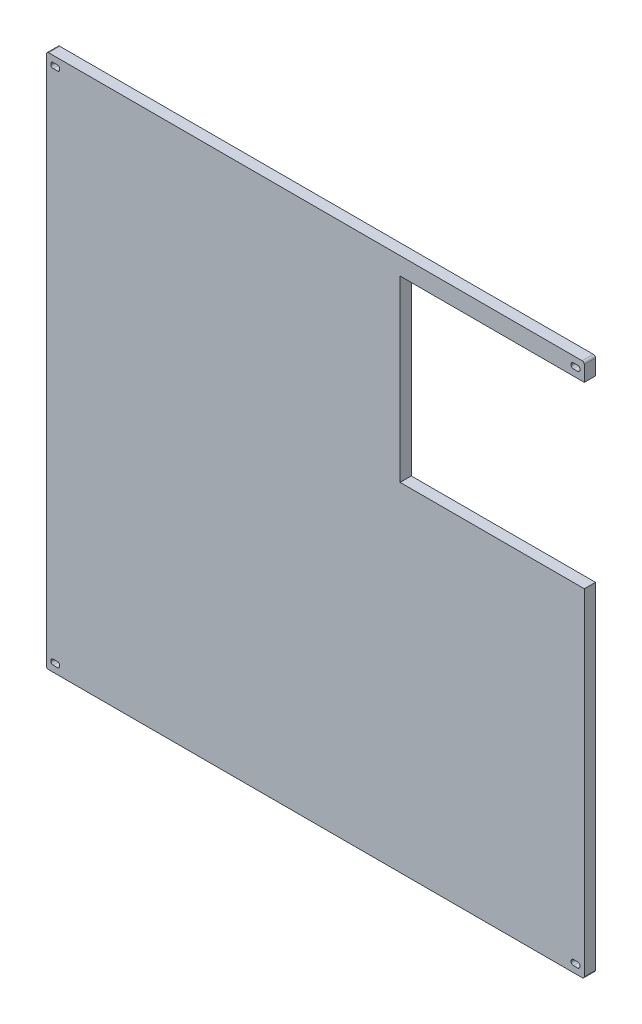
from build123d import *

# Parameters (mm, degrees)
BOSS_EXTRUDE2_DEPTH = 12.7
FILLET2_R           = 2.5


with BuildPart() as part:
    # Sketch1 → Boss-Extrude2 (new body)
    with BuildSketch(Plane.XY):
        Polygon((0, 0), (-611.632, 0), (-611.632, 607.568), (0, 607.568), (0, 587.480907233), (-209.519092864, 587.480907233), (-209.519092864, 384.280907233), (0, 384.280907233), align=None)
        with BuildLine():
            Line((-5, 10.5), (-5, 9.5))
            ThreePointArc((-5, 9.5), (-5.732233047, 7.732233047), (-7.5, 7))
            Line((-7.5, 7), (-12.5, 7))
            ThreePointArc((-12.5, 7), (-14.267766953, 7.732233047), (-15, 9.5))
            Line((-15, 9.5), (-15, 10.5))
            ThreePointArc((-15, 10.5), (-14.267766953, 12.267766953), (-12.5, 13))
            Line((-12.5, 13), (-7.5, 13))
            ThreePointArc((-7.5, 13), (-5.732233047, 12.267766953), (-5, 10.5))
        make_face(mode=Mode.SUBTRACT)
        with BuildLine():
            Line((-596.63, 10.5), (-596.63, 9.5))
            ThreePointArc((-596.63, 9.5), (-597.362233047, 7.732233047), (-599.13, 7))
            Line((-599.13, 7), (-604.13, 7))
            ThreePointArc((-604.13, 7), (-605.897766953, 7.732233047), (-606.63, 9.5))
            Line((-606.63, 9.5), (-606.63, 10.5))
            ThreePointArc((-606.63, 10.5), (-605.897766953, 12.267766953), (-604.13, 13))
            Line((-604.13, 13), (-599.13, 13))
            ThreePointArc((-599.13, 13), (-597.362233047, 12.267766953), (-596.63, 10.5))
        make_face(mode=Mode.SUBTRACT)
        with BuildLine():
            Line((-596.63, 598.07), (-596.63, 597.07))
            ThreePointArc((-596.63, 597.07), (-597.362233047, 595.302233047), (-599.13, 594.57))
            Line((-599.13, 594.57), (-604.13, 594.57))
            ThreePointArc((-604.13, 594.57), (-605.897766953, 595.302233047), (-606.63, 597.07))
            Line((-606.63, 597.07), (-606.63, 598.07))
            ThreePointArc((-606.63, 598.07), (-605.897766953, 599.837766953), (-604.13, 600.57))
            Line((-604.13, 600.57), (-599.13, 600.57))
            ThreePointArc((-599.13, 600.57), (-597.362233047, 599.837766953), (-596.63, 598.07))
        make_face(mode=Mode.SUBTRACT)
        with BuildLine():
            Line((-5, 598.07), (-5, 597.07))
            ThreePointArc((-5, 597.07), (-5.732233047, 595.302233047), (-7.5, 594.57))
            Line((-7.5, 594.57), (-12.5, 594.57))
            ThreePointArc((-12.5, 594.57), (-14.267766953, 595.302233047), (-15, 597.07))
            Line((-15, 597.07), (-15, 598.07))
            ThreePointArc((-15, 598.07), (-14.267766953, 599.837766953), (-12.5, 600.57))
            Line((-12.5, 600.57), (-7.5, 600.57))
            ThreePointArc((-7.5, 600.57), (-5.732233047, 599.837766953), (-5, 598.07))
        make_face(mode=Mode.SUBTRACT)
    extrude(amount=BOSS_EXTRUDE2_DEPTH)

    # Fillet2
    fillet2_edges = [part.edges().sort_by_distance(p)[0] for p in [
        (0, 0, 6.35),
        (-611.632, 0, 6.35),
        (-611.632, 607.568, 6.35),
        (0, 607.568, 6.35),
    ]]
    fillet(fillet2_edges, radius=FILLET2_R)


solid = part.part
